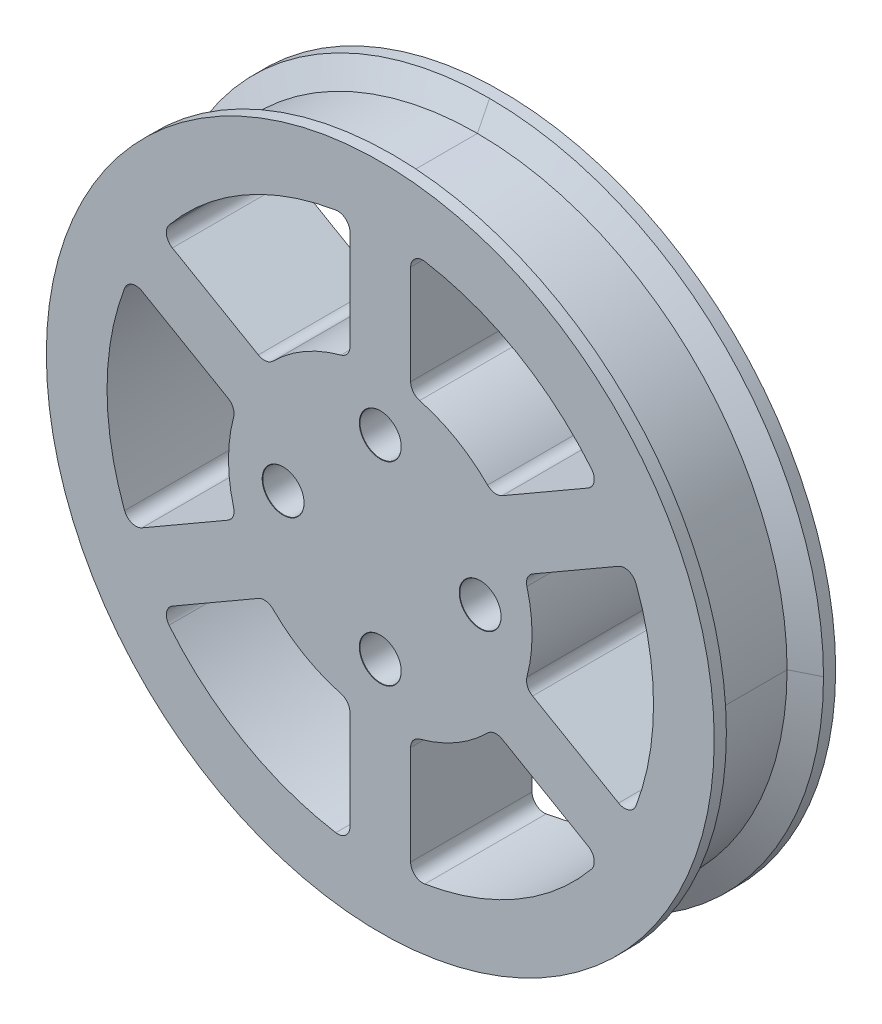
from build123d import *

# Parameters (mm, degrees)
SKETCH_1_R                  = 27.5
EXTRUDE_1_DEPTH             = 10
CUT_EXTRUDE_1_REACH         = 42.156
SKETCH_2_R                  = 22.5
SKETCH_3_R                  = 12.5
EXTRUDE_2_DEPTH             = 10
EXTRUDE_START               = 10
EXTRUDE_3_DEPTH             = 10
HOLE_WIZARD_M32_D           = 3.4
HOLE_WIZARD_M32_CSINK_D     = 3.45
HOLE_WIZARD_M32_CSINK_ANGLE = 90
FILLET_1_R                  = 1


with BuildPart() as part:
    # Эскиз1 → Бобышка-Вытянуть1 (new body)
    with BuildSketch(Plane.XY):
        Circle(SKETCH_1_R)
    extrude(amount=EXTRUDE_1_DEPTH)

    # Эскиз2 → Вырез-Вытянуть1 (cut, up to next)
    with BuildSketch(Plane.XY.offset(10), mode=Mode.PRIVATE) as cut_extrude_1_sk1:
        Circle(SKETCH_2_R)
    cut_extrude_1_tool1 = extrude(cut_extrude_1_sk1.sketch, amount=-CUT_EXTRUDE_1_REACH, mode=Mode.PRIVATE) & part.part
    add(cut_extrude_1_tool1.solids().sort_by_distance((0, 0, 10))[0], mode=Mode.SUBTRACT)



with BuildPart() as body_2:
    # Эскиз3 → Бобышка-Вытянуть2 (new body)
    with BuildSketch(Plane.XY):
        Circle(SKETCH_3_R)
    extrude(amount=EXTRUDE_2_DEPTH)


with BuildPart() as part_1:
    add(part.part)

    add(body_2.part)  # Бобышка-Вытянуть3 merges body 2
    # Эскиз5 → Бобышка-Вытянуть3 (add)
    with BuildSketch(Plane.XY.offset(EXTRUDE_START)):
        with BuildLine():
            Line((9.356601718, 8.288787866), (18.114916731, 13.345403397))
            ThreePointArc((18.114916731, 13.345403397), (19.485571585, 11.25), (20.614916731, 9.015276378))
            Line((20.614916731, 9.015276378), (11.856601718, 3.958660847))
            ThreePointArc((11.856601718, 3.958660847), (10.825317547, 6.25), (9.356601718, 8.288787866))
        make_face()
        with BuildLine():
            Line((2.5, 12.247448714), (2.5, 22.360679775))
            ThreePointArc((2.5, 22.360679775), (0, 22.5), (-2.5, 22.360679775))
            Line((-2.5, 22.360679775), (-2.5, 12.247448714))
            ThreePointArc((-2.5, 12.247448714), (0, 12.5), (2.5, 12.247448714))
        make_face()
        with BuildLine():
            Line((11.856601718, -3.958660847), (20.614916731, -9.015276378))
            ThreePointArc((20.614916731, -9.015276378), (19.485571585, -11.25), (18.114916731, -13.345403397))
            Line((18.114916731, -13.345403397), (9.356601718, -8.288787866))
            ThreePointArc((9.356601718, -8.288787866), (10.825317547, -6.25), (11.856601718, -3.958660847))
        make_face()
        with BuildLine():
            Line((2.5, -12.247448714), (2.5, -22.360679775))
            ThreePointArc((2.5, -22.360679775), (0, -22.5), (-2.5, -22.360679775))
            Line((-2.5, -22.360679775), (-2.5, -12.247448714))
            ThreePointArc((-2.5, -12.247448714), (0, -12.5), (2.5, -12.247448714))
        make_face()
        with BuildLine():
            Line((-9.356601718, -8.288787866), (-18.114916731, -13.345403397))
            ThreePointArc((-18.114916731, -13.345403397), (-19.485571585, -11.25), (-20.614916731, -9.015276378))
            Line((-20.614916731, -9.015276378), (-11.856601718, -3.958660847))
            ThreePointArc((-11.856601718, -3.958660847), (-10.825317547, -6.25), (-9.356601718, -8.288787866))
        make_face()
        with BuildLine():
            Line((-11.856601718, 3.958660847), (-20.614916731, 9.015276378))
            ThreePointArc((-20.614916731, 9.015276378), (-19.485571585, 11.25), (-18.114916731, 13.345403397))
            Line((-18.114916731, 13.345403397), (-9.356601718, 8.288787866))
            ThreePointArc((-9.356601718, 8.288787866), (-10.825317547, 6.25), (-11.856601718, 3.958660847))
        make_face()
    extrude(amount=-EXTRUDE_3_DEPTH)

    # Отверстие с зазором M32 (through all)
    with Locations(Plane.XY.offset(10)):
        with Locations((-8, 0), (0, 8), (8.225054206, 0), (0, -8)):
            CounterSinkHole(HOLE_WIZARD_M32_D / 2, HOLE_WIZARD_M32_CSINK_D / 2, counter_sink_angle=HOLE_WIZARD_M32_CSINK_ANGLE)

    # Скругление1
    fillet_1_edges = [part_1.edges().sort_by_distance(p)[0] for p in [
        (-2.5, 12.247448714, 5),
        (2.5, 12.247448714, 5),
        (2.5, 22.360679775, 5),
        (-2.5, 22.360679775, 5),
        (9.356601718, 8.288787866, 5),
        (11.856601718, 3.958660847, 5),
        (20.614916731, 9.015276378, 5),
        (18.114916731, 13.345403397, 5),
        (11.856601718, -3.958660847, 5),
        (9.356601718, -8.288787866, 5),
        (18.114916731, -13.345403397, 5),
        (20.614916731, -9.015276378, 5),
        (2.5, -12.247448714, 5),
        (-2.5, -12.247448714, 5),
        (-2.5, -22.360679775, 5),
        (2.5, -22.360679775, 5),
        (-9.356601718, -8.288787866, 5),
        (-11.856601718, -3.958660847, 5),
        (-20.614916731, -9.015276378, 5),
        (-18.114916731, -13.345403397, 5),
        (-11.856601718, 3.958660847, 5),
        (-9.356601718, 8.288787866, 5),
        (-18.114916731, 13.345403397, 5),
        (-20.614916731, 9.015276378, 5),
    ]]
    fillet(fillet_1_edges, radius=FILLET_1_R)

    # Вырез-По траектории2: sweep along a curve in space
    with BuildLine() as sweep_2_path:
        ThreePointArc((27.5, 0, 10), (19.445436483, 19.445436483, 10), (0, 27.5, 10))
        ThreePointArc((0, 27.5, 10), (-19.445436483, 19.445436483, 10), (-27.5, 0, 10))
        ThreePointArc((-27.5, 0, 10), (-19.445436483, -19.445436483, 10), (0, -27.5, 10))
        ThreePointArc((0, -27.5, 10), (19.445436483, -19.445436483, 10), (27.5, 0, 10))
    # Эскиз13 → Вырез-По траектории2 (sweep, cut)
    with BuildSketch(Plane(origin=(0, 0, 0), x_dir=(0, 0, -1), z_dir=(1, 0, 0))):
        Polygon((-8, 25.5), (-2, 25.5), (-1, 27.5), (-9, 27.5), align=None)
    sweep(path=sweep_2_path.line, mode=Mode.SUBTRACT)


solid = part_1.part
